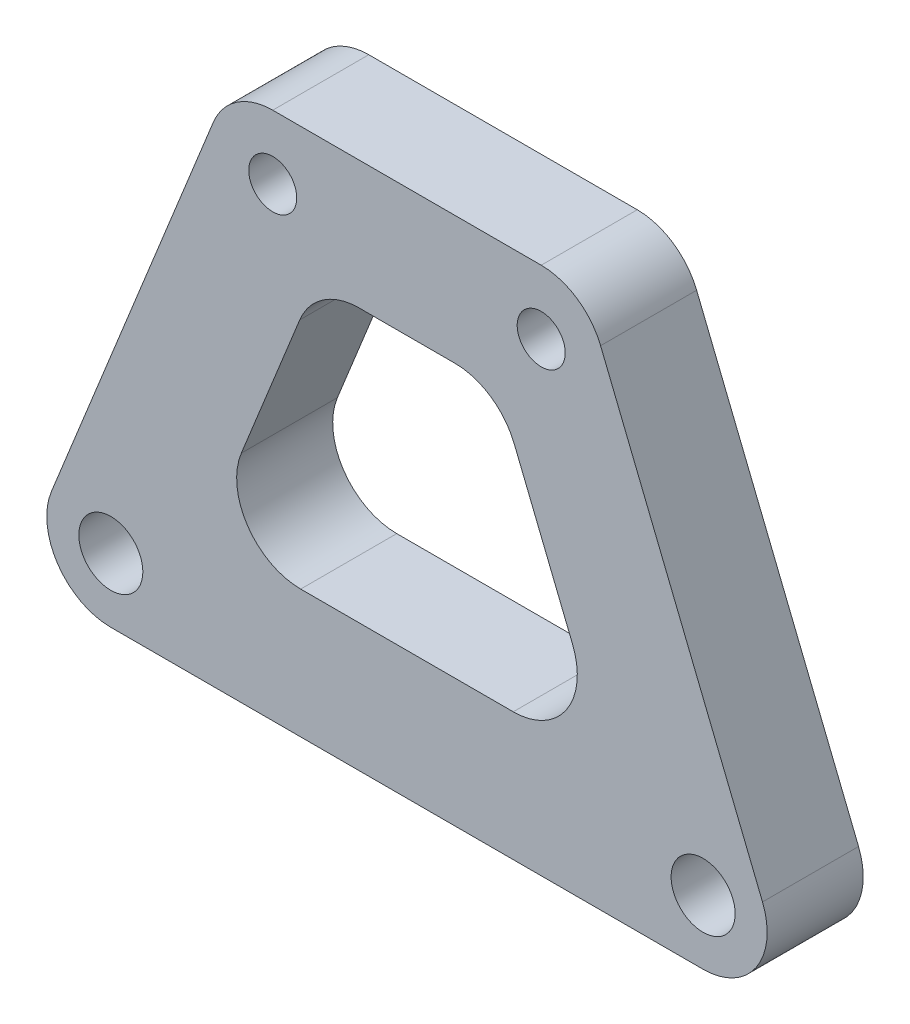
from build123d import *

# Parameters (mm, degrees)
EXTRUDE_1_DEPTH     = 6
SKETCH_5_R          = 2
SKETCH_5_R_2        = 1.5
CUT_EXTRUDE_3_DEPTH = 53.172568548
FILLET_1_R          = 4


with BuildPart() as part:
    # d → 凸台-拉伸1 (new body)
    # profile 1 of 2: a face of its own
    with BuildSketch(Plane.XY):
        Polygon((-5.930243874, -4), (7.416343955, 29.033964073), (29.583656045, 29.033964073), (42.930243874, -4), align=None)
        Polygon((0, 0), (37, 0), (26.885621978, 25.033964073), (10.114378022, 25.033964073), align=None, mode=Mode.SUBTRACT)
    # profile 2 of 2: a face of its own
    with BuildSketch(Plane.XY):
        Polygon((0, 0), (10.114378022, 25.033964073), (26.885621978, 25.033964073), (37, 0), align=None)
        Polygon((5.930243874, 4), (31.069756126, 4), (24.18758791, 21.033964073), (12.81241209, 21.033964073), align=None, mode=Mode.SUBTRACT)
    extrude(amount=EXTRUDE_1_DEPTH)

    # 草图5 → 切除-拉伸3 (cut, through all)
    with BuildSketch(Plane.XY.offset(6)):
        Circle(SKETCH_5_R)
        with Locations((37, 0)):
            Circle(SKETCH_5_R)
        with Locations((26.885621978, 25.033964073)):
            Circle(SKETCH_5_R_2)
        with Locations((10.114378022, 25.033964073)):
            Circle(SKETCH_5_R_2)
    extrude(amount=-CUT_EXTRUDE_3_DEPTH, mode=Mode.SUBTRACT)

    # 圆角1
    fillet_1_edges = [part.edges().sort_by_distance(p)[0] for p in [
        (31.069756126, 4, 3),
        (24.18758791, 21.033964073, 3),
        (12.81241209, 21.033964073, 3),
        (5.930243874, 4, 3),
        (7.416343955, 29.033964073, 3),
        (29.583656045, 29.033964073, 3),
        (42.930243874, -4, 3),
        (-5.930243874, -4, 3),
    ]]
    fillet(fillet_1_edges, radius=FILLET_1_R)


solid = part.part
